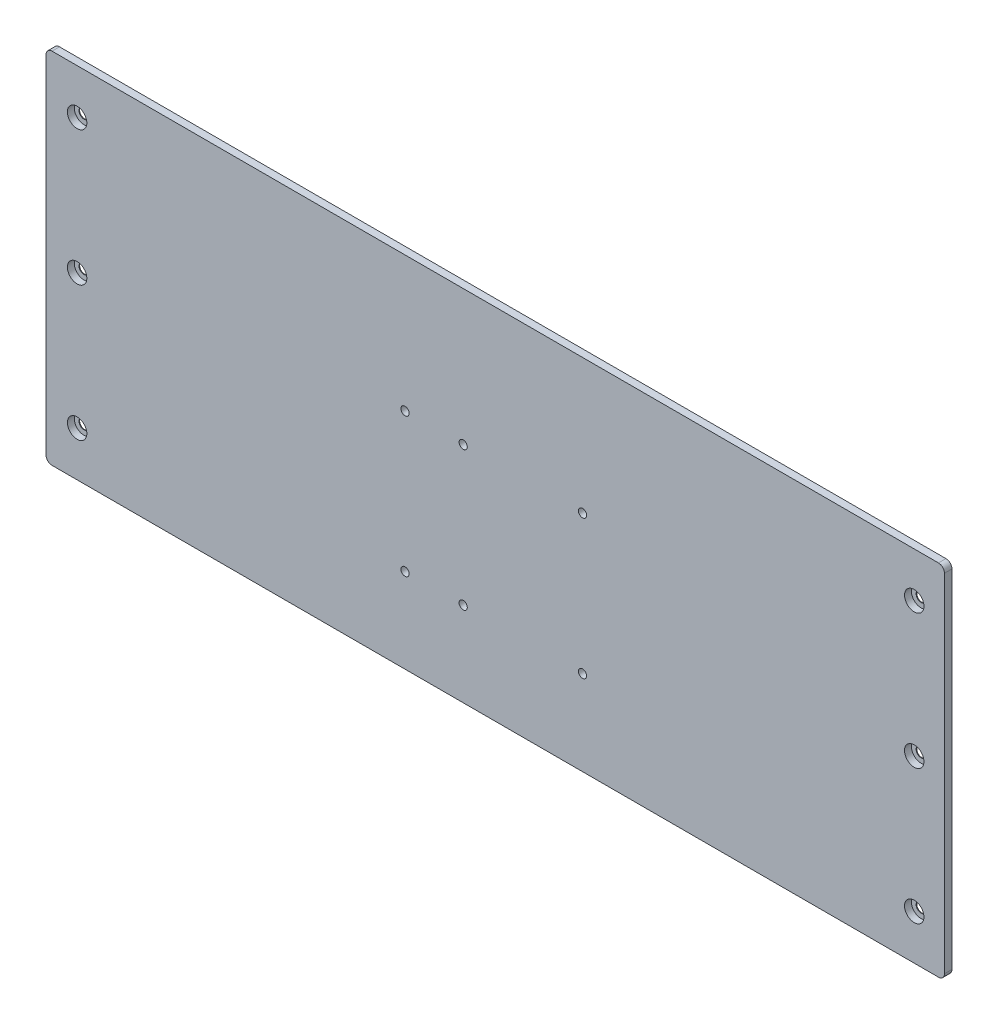
from build123d import *

# Parameters (mm, degrees)
BOSS_EXTRUDE1_DEPTH                           = 5
CBORE_FOR_M6_PAN_HEAD_MACHINE_SCREW1_AT_COUNT = 2
CBORE_FOR_M6_PAN_HEAD_MACHINE_SCREW1_AT_PITCH = 90
CBORE_FOR_M6_PAN_HEAD_MACHINE_SCREW1_2_COUNT  = 2
CBORE_FOR_M6_PAN_HEAD_MACHINE_SCREW1_2_PITCH  = 90
LPATTERN1_COUNT                               = 2
LPATTERN1_PITCH                               = 560
M5_CLEARANCE_HOLE1_AT_2_COUNT                 = 2
M5_CLEARANCE_HOLE1_AT_2_PITCH                 = 38.907056767
M5_CLEARANCE_HOLE1_AT_3_COUNT                 = 2
M5_CLEARANCE_HOLE1_AT_3_PITCH                 = 118.743434782
LPATTERN2_COUNT                               = 2
LPATTERN2_PITCH                               = 93


with BuildPart() as part:
    # Sketch1 → Boss-Extrude1 (new body)
    with BuildSketch(Plane.XY):
        with BuildLine():
            Line((-296.5, -120), (296.5, -120))
            ThreePointArc((296.5, -120), (299.328427125, -118.828427125), (300.5, -116))
            Line((300.5, -116), (300.5, 116))
            ThreePointArc((300.5, 116), (299.328427125, 118.828427125), (296.5, 120))
            Line((296.5, 120), (-296.5, 120))
            ThreePointArc((-296.5, 120), (-299.328427125, 118.828427125), (-300.5, 116))
            Line((-300.5, 116), (-300.5, -116))
            ThreePointArc((-300.5, -116), (-299.328427125, -118.828427125), (-296.5, -120))
        make_face()
    extrude(amount=BOSS_EXTRUDE1_DEPTH)

    # Sketch2 → CBORE for M6 Pan Head Machine Screw1 (revolve, cut)
    with BuildSketch(Plane(origin=(280.273194374, 0, 5), x_dir=(0, -1, 0), z_dir=(1, 0, 0))):
        Polygon((0, 0), (0, 6.982840043), (3.3, 5), (3.3, 4.625), (3.325, 4.6), (6.5, 4.6), (6.5, 0), align=None)
    cbore_for_m6_pan_head_machine_screw1 = revolve(axis=Axis((280.273194374, 0, 11.35), (0, 0, -1)), mode=Mode.SUBTRACT)

    # CBORE for M6 Pan Head Machine Screw1 at: CBORE for M6 Pan Head Machine Screw1 ×2
    with Locations(*[(0, i * CBORE_FOR_M6_PAN_HEAD_MACHINE_SCREW1_AT_PITCH, 0) for i in range(1, CBORE_FOR_M6_PAN_HEAD_MACHINE_SCREW1_AT_COUNT)]):
        add(cbore_for_m6_pan_head_machine_screw1, mode=Mode.SUBTRACT)

    # CBORE for M6 Pan Head Machine Screw1 2: CBORE for M6 Pan Head Machine Screw1 ×2
    with Locations(*[(0, -i * CBORE_FOR_M6_PAN_HEAD_MACHINE_SCREW1_2_PITCH, 0) for i in range(1, CBORE_FOR_M6_PAN_HEAD_MACHINE_SCREW1_2_COUNT)]):
        add(cbore_for_m6_pan_head_machine_screw1, mode=Mode.SUBTRACT)

    # LPattern1: CBORE for M6 Pan Head Machine Screw1 ×2
    with Locations(*[(-i * LPATTERN1_PITCH, 0, 0) for i in range(1, LPATTERN1_COUNT)]):
        add(cbore_for_m6_pan_head_machine_screw1, mode=Mode.SUBTRACT)

    # LPattern1 copy 1 sketch → LPattern1 copy 1 (revolve, cut)
    with BuildSketch(Plane(origin=(-279.726805626, 90, 5), x_dir=(0, -1, 0), z_dir=(1, 0, 0))):
        Polygon((0, 0), (0, 6.982840043), (3.3, 5), (3.3, 4.625), (3.325, 4.6), (6.5, 4.6), (6.5, 0), align=None)
    revolve(axis=Axis((-279.726805626, 90, 11.35), (0, 0, -1)), mode=Mode.SUBTRACT)

    # LPattern1 copy 2 sketch → LPattern1 copy 2 (revolve, cut)
    with BuildSketch(Plane(origin=(-279.726805626, -90, 5), x_dir=(0, -1, 0), z_dir=(1, 0, 0))):
        Polygon((0, 0), (0, 6.982840043), (3.3, 5), (3.3, 4.625), (3.325, 4.6), (6.5, 4.6), (6.5, 0), align=None)
    revolve(axis=Axis((-279.726805626, -90, 11.35), (0, 0, -1)), mode=Mode.SUBTRACT)

    # Sketch4 → M5 Clearance Hole1 (revolve, cut)
    with BuildSketch(Plane(origin=(-60.375010772, -63.419690337, 5), x_dir=(0, -1, 0), z_dir=(1, 0, 0))):
        Polygon((0, 0), (0, 6.652366702), (2.75, 5), (2.75, 0), align=None)
    m5_clearance_hole1 = revolve(axis=Axis((-60.375010772, -63.419690337, 11.35), (0, 0, -1)), mode=Mode.SUBTRACT)

    # M5 Clearance Hole1 at 2: M5 Clearance Hole1 ×2
    with Locations(*[(i * M5_CLEARANCE_HOLE1_AT_2_PITCH, 0, 0) for i in range(1, M5_CLEARANCE_HOLE1_AT_2_COUNT)]):
        add(m5_clearance_hole1, mode=Mode.SUBTRACT)

    # M5 Clearance Hole1 at 3: M5 Clearance Hole1 ×2
    with Locations(*[Vector(0.9999978769286347, 0.002060615981510638, 0) * (i * M5_CLEARANCE_HOLE1_AT_3_PITCH) for i in range(1, M5_CLEARANCE_HOLE1_AT_3_COUNT)]):
        add(m5_clearance_hole1, mode=Mode.SUBTRACT)

    # LPattern2: M5 Clearance Hole1 ×2
    with Locations(*[(0, i * LPATTERN2_PITCH, 0) for i in range(1, LPATTERN2_COUNT)]):
        add(m5_clearance_hole1, mode=Mode.SUBTRACT)

    # LPattern2 copy 1 sketch → LPattern2 copy 1 (revolve, cut)
    with BuildSketch(Plane(origin=(-21.467954006, 29.580309663, 5), x_dir=(0, -1, 0), z_dir=(1, 0, 0))):
        Polygon((0, 0), (0, 6.652366702), (2.75, 5), (2.75, 0), align=None)
    revolve(axis=Axis((-21.467954006, 29.580309663, 11.35), (0, 0, -1)), mode=Mode.SUBTRACT)

    # LPattern2 copy 2 sketch → LPattern2 copy 2 (revolve, cut)
    with BuildSketch(Plane(origin=(58.368171909, 29.824994283, 5), x_dir=(0, -1, 0), z_dir=(1, 0, 0))):
        Polygon((0, 0), (0, 6.652366702), (2.75, 5), (2.75, 0), align=None)
    revolve(axis=Axis((58.368171909, 29.824994283, 11.35), (0, 0, -1)), mode=Mode.SUBTRACT)


solid = part.part
